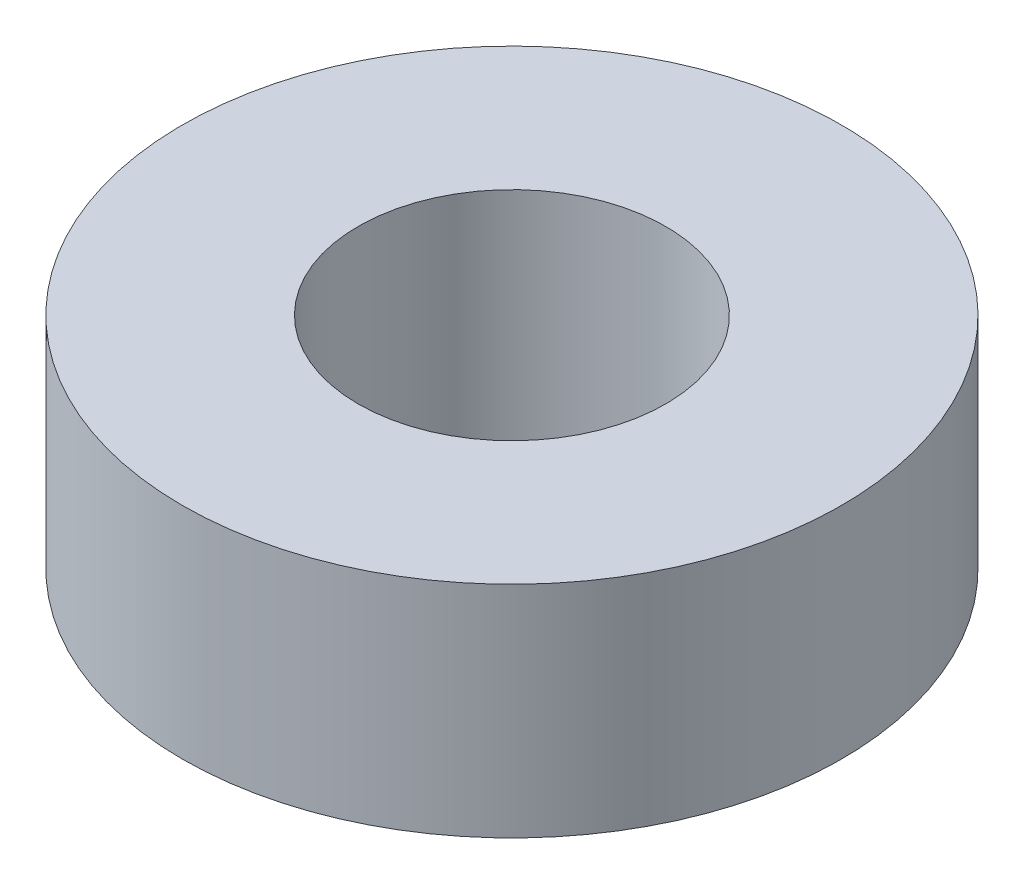
from build123d import *

# Parameters (mm, degrees)
SKETCH1_R           = 15
SKETCH1_R_2         = 7
BOSS_EXTRUDE1_DEPTH = 10


with BuildPart() as part:
    # Sketch1 → Boss-Extrude1 (new body)
    with BuildSketch(Plane(origin=(0, 0, 0), x_dir=(1, 0, 0), z_dir=(0, 1, 0))):
        with Locations(Location((0, 0, 0), (0, 0, 270))):
            Circle(SKETCH1_R)
        with Locations(Location((0, 0, 0), (0, 0, 270))):
            Circle(SKETCH1_R_2, mode=Mode.SUBTRACT)
    extrude(amount=BOSS_EXTRUDE1_DEPTH)


solid = part.part
